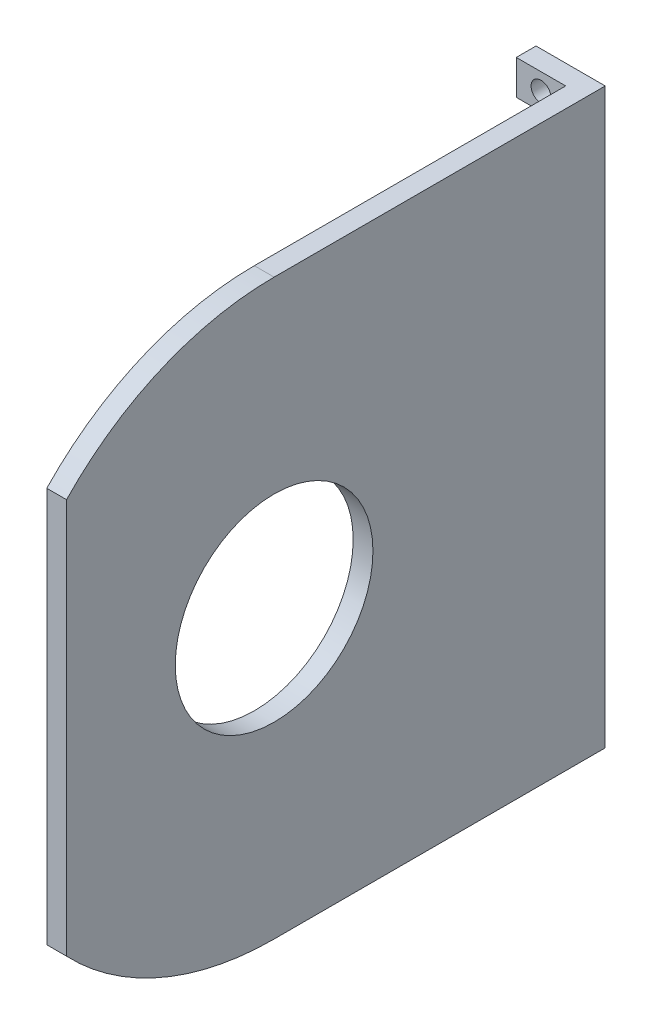
from build123d import *

# Parameters (mm, degrees)
SKETCH1_R           = 12
BOSS_EXTRUDE1_DEPTH = 4
SKETCH7_W           = 10
SKETCH7_H           = 7
SKETCH7_R           = 2
BOSS_EXTRUDE4_DEPTH = 4
SKETCH8_R           = 20
CUT_EXTRUDE3_DEPTH  = 86.850160163
CUT_EXTRUDE4_DEPTH  = 87.407464955


with BuildPart() as part:
    # Sketch1 → Boss-Extrude1 (new body)
    with BuildSketch(Plane(origin=(0, 0, 0), x_dir=(0, 0, -1), z_dir=(1, 0, 0))):
        with BuildLine():
            Line((62.5, 58), (-4.5, 58))
            ThreePointArc((-4.5, 58), (-62.5, 0), (-4.5, -58))
            Line((-4.5, -58), (62.5, -58))
            Line((62.5, -58), (62.5, 58))
        make_face()
        with Locations((-4.5, 0)):
            Circle(SKETCH1_R, mode=Mode.SUBTRACT)
    extrude(amount=BOSS_EXTRUDE1_DEPTH)

    # Sketch7 → Boss-Extrude4 (add)
    # profile 1 of 2: a face of its own
    with BuildSketch(Plane(origin=(0, 0, -62.5), x_dir=(-1, 0, 0), z_dir=(0, 0, -1))):
        with Locations((5, 54.5)):
            Rectangle(SKETCH7_W, SKETCH7_H)
        with Locations((5, 54.5)):
            Circle(SKETCH7_R, mode=Mode.SUBTRACT)
    # profile 2 of 2: a face of its own
    with BuildSketch(Plane(origin=(0, 0, -62.5), x_dir=(-1, 0, 0), z_dir=(0, 0, -1))):
        with Locations((5, -54.5)):
            Rectangle(SKETCH7_W, SKETCH7_H)
        with Locations(Location((5, -54.5, 0), (0, 0, 180))):
            Circle(SKETCH7_R, mode=Mode.SUBTRACT)
    extrude(amount=-BOSS_EXTRUDE4_DEPTH)

    # Sketch8 → Cut-Extrude3 (cut, through all)
    with BuildSketch(Plane.ZY):
        with Locations((4.5, 0)):
            Circle(SKETCH8_R)
    extrude(amount=-CUT_EXTRUDE3_DEPTH, mode=Mode.SUBTRACT)

    # Sketch9 → Cut-Extrude4 (cut, through all)
    with BuildSketch(Plane(origin=(4, 0, 0), x_dir=(0, 0, -1), z_dir=(1, 0, 0))):
        with BuildLine():
            Line((-46.5, 40), (-46.5, -40))
            ThreePointArc((-46.5, -40), (-62.5, 0), (-46.5, 40))
        make_face()
    extrude(amount=-CUT_EXTRUDE4_DEPTH, mode=Mode.SUBTRACT)


solid = part.part
